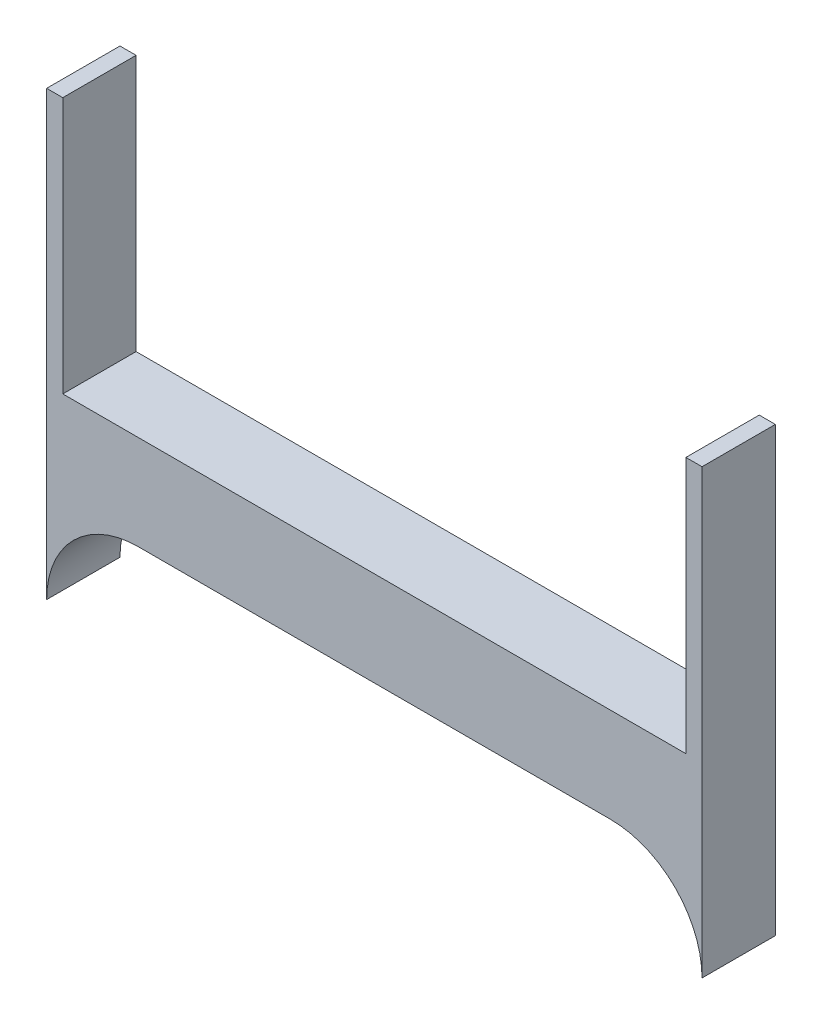
from build123d import *

# Parameters (mm, degrees)
BOSS_EXTRUDE1_DEPTH = 1


with BuildPart() as part:
    # Sketch1 → Boss-Extrude1 (new body)
    with BuildSketch(Plane.XY):
        with BuildLine():
            Line((0, -6.04), (0, 0))
            Line((0, 0), (0.22, 0))
            Line((0.22, 0), (0.22, -3.5))
            Line((0.22, -3.5), (8.72, -3.5))
            Line((8.72, -3.5), (8.72, 0))
            Line((8.72, 0), (8.94, 0))
            Line((8.94, 0), (8.94, -6.04))
            ThreePointArc((8.94, -6.04), (8.573883476, -5.156116524), (7.69, -4.79))
            Line((7.69, -4.79), (1.25, -4.79))
            ThreePointArc((1.25, -4.79), (0.366116524, -5.156116524), (0, -6.04))
        make_face()
    extrude(amount=BOSS_EXTRUDE1_DEPTH)


solid = part.part
